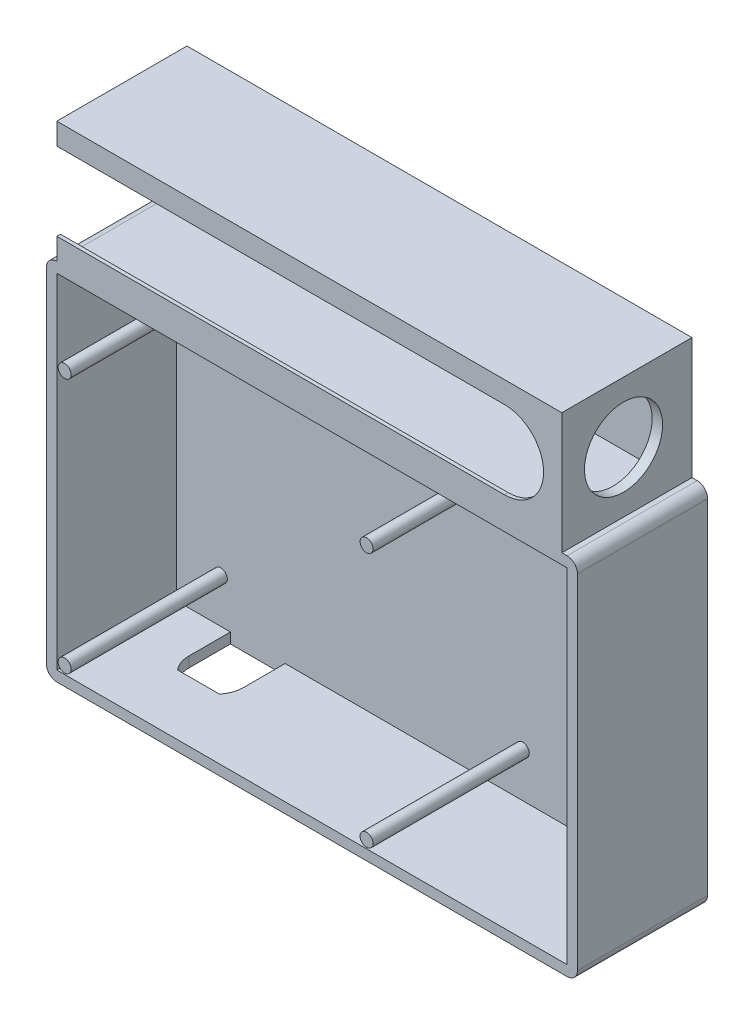
from build123d import *

# Parameters (mm, degrees)
SKETCH1_W           = 98
SKETCH1_H           = 66
SKETCH1_R           = 1.25
BOSS_EXTRUDE1_DEPTH = 2
SKETCH1_3_R         = 1.25
BOSS_EXTRUDE2_DEPTH = 32
SKETCH2_W           = 98
SKETCH2_H           = 66
BOSS_EXTRUDE3_DEPTH = 25
CUT_EXTRUDE1_DEPTH  = 25
BOSS_EXTRUDE4_DEPTH = 95
SKETCH5_W           = 24
SKETCH5_H           = 23.3
BOSS_EXTRUDE5_DEPTH = 2
BOSS_EXTRUDE6_DEPTH = 0.3
BOSS_EXTRUDE7_DEPTH = 0.7
CUT_EXTRUDE2_DEPTH  = 2


with BuildPart() as part:
    # Sketch1 → Boss-Extrude1 (new body)
    with BuildSketch(Plane.XY):
        with Locations((44, 28)):
            Rectangle(SKETCH1_W, SKETCH1_H)
        with Locations((61.5, 3.5)):
            Circle(SKETCH1_R, mode=Mode.SUBTRACT)
        with Locations((3.5, 52.5)):
            Circle(SKETCH1_R, mode=Mode.SUBTRACT)
        with Locations((61.5, 52.5)):
            Circle(SKETCH1_R, mode=Mode.SUBTRACT)
        with Locations((3.5, 3.5)):
            Circle(SKETCH1_R, mode=Mode.SUBTRACT)
    extrude(amount=BOSS_EXTRUDE1_DEPTH)

    # Sketch1<3> → Boss-Extrude2 (add)
    with BuildSketch(Plane.XY):
        with Locations((3.5, 52.5)):
            Circle(SKETCH1_3_R)
        with Locations((61.5, 52.5)):
            Circle(SKETCH1_3_R)
        with Locations((61.5, 3.5)):
            Circle(SKETCH1_3_R)
        with Locations((3.5, 3.5)):
            Circle(SKETCH1_3_R)
    extrude(amount=BOSS_EXTRUDE2_DEPTH)

    # Sketch2 → Boss-Extrude3 (add)
    with BuildSketch(Plane(origin=(0, 0, 0), x_dir=(-1, 0, 0), z_dir=(0, 0, -1))):
        with BuildLine():
            Line((7, -5), (7, 61))
            ThreePointArc((7, 61), (6.414213562, 62.414213562), (5, 63))
            Line((5, 63), (-93, 63))
            ThreePointArc((-93, 63), (-94.414213562, 62.414213562), (-95, 61))
            Line((-95, 61), (-95, -5))
            ThreePointArc((-95, -5), (-94.414213562, -6.414213562), (-93, -7))
            Line((-93, -7), (5, -7))
            ThreePointArc((5, -7), (6.414213562, -6.414213562), (7, -5))
        make_face()
        with Locations((-44, 28)):
            Rectangle(SKETCH2_W, SKETCH2_H, mode=Mode.SUBTRACT)
    extrude(amount=-BOSS_EXTRUDE3_DEPTH)

    # Sketch3 → Cut-Extrude1 (cut)
    with BuildSketch(Plane.XZ.offset(7)):
        with BuildLine():
            Line((15.85, 10), (15.85, 2))
            Line((15.85, 2), (5.35, 2))
            Line((5.35, 2), (5.35, 10))
            ThreePointArc((5.35, 10), (5.672315931, 11.81119566), (6.599687512, 13.4))
            Line((6.599687512, 13.4), (14.600312488, 13.4))
            ThreePointArc((14.600312488, 13.4), (15.527684069, 11.81119566), (15.85, 10))
        make_face()
    extrude(amount=-CUT_EXTRUDE1_DEPTH, mode=Mode.SUBTRACT)

    # Sketch4 → Boss-Extrude4 (add)
    with BuildSketch(Plane(origin=(-5, 0, 0), x_dir=(0, 0, -1), z_dir=(1, 0, 0))):
        Polygon((-24, 84.3), (-24, 86.3), (0, 86.3), (0, 63), (-2, 63), (-2, 84.3), align=None)
    extrude(amount=BOSS_EXTRUDE4_DEPTH)

    # Sketch5 → Boss-Extrude5 (add)
    with BuildSketch(Plane(origin=(90, 0, 0), x_dir=(0, 0, -1), z_dir=(1, 0, 0))):
        with Locations((-12, 74.65)):
            Rectangle(SKETCH5_W, SKETCH5_H)
    extrude(amount=BOSS_EXTRUDE5_DEPTH)

    # Sketch6 → Boss-Extrude6 (add)
    with BuildSketch(Plane.XY.offset(24)):
        Polygon((-5, 84.3), (-5, 86.3), (92, 86.3), (92, 63), (90, 63), (90, 84.3), align=None)
    extrude(amount=BOSS_EXTRUDE6_DEPTH)

    # Sketch7 → Boss-Extrude7 (add)
    with BuildSketch(Plane(origin=(-5, 84.3, 24.3), x_dir=(1, 0, 0), z_dir=(0, 0, 1))):
        with BuildLine():
            Line((97, -21.3), (97, -9.65))
            Line((97, -9.65), (93.5, -9.65))
            ThreePointArc((93.5, -9.65), (91.303300859, -14.953300859), (86, -17.15))
            Line((86, -17.15), (0, -17.15))
            Line((0, -17.15), (0, -21.3))
            Line((0, -21.3), (97, -21.3))
        make_face()
        with BuildLine():
            Line((93.5, -9.65), (97, -9.65))
            Line((97, -9.65), (97, 2))
            Line((97, 2), (0, 2))
            Line((0, 2), (0, -2.15))
            Line((0, -2.15), (86, -2.15))
            ThreePointArc((86, -2.15), (91.303300859, -4.346699141), (93.5, -9.65))
        make_face()
    extrude(amount=BOSS_EXTRUDE7_DEPTH)

    # Sketch8 → Cut-Extrude2 (cut)
    with BuildSketch(Plane(origin=(92, 0, 0), x_dir=(0, 0, -1), z_dir=(1, 0, 0))):
        with BuildLine():
            ThreePointArc((-7.536194091, 79.62344782), (-18.12344782, 80.263805909), (-18.763805909, 69.67655218))
            Line((-18.763805909, 69.67655218), (-7.536194091, 79.62344782))
        make_face()
        with BuildLine():
            Line((-7.536194091, 79.62344782), (-18.763805909, 69.67655218))
            ThreePointArc((-18.763805909, 69.67655218), (-10.490445932, 67.637384785), (-5.65, 74.65))
            ThreePointArc((-5.65, 74.65), (-6.137384785, 77.309554068), (-7.536194091, 79.62344782))
        make_face()
    extrude(amount=-CUT_EXTRUDE2_DEPTH, mode=Mode.SUBTRACT)


solid = part.part
